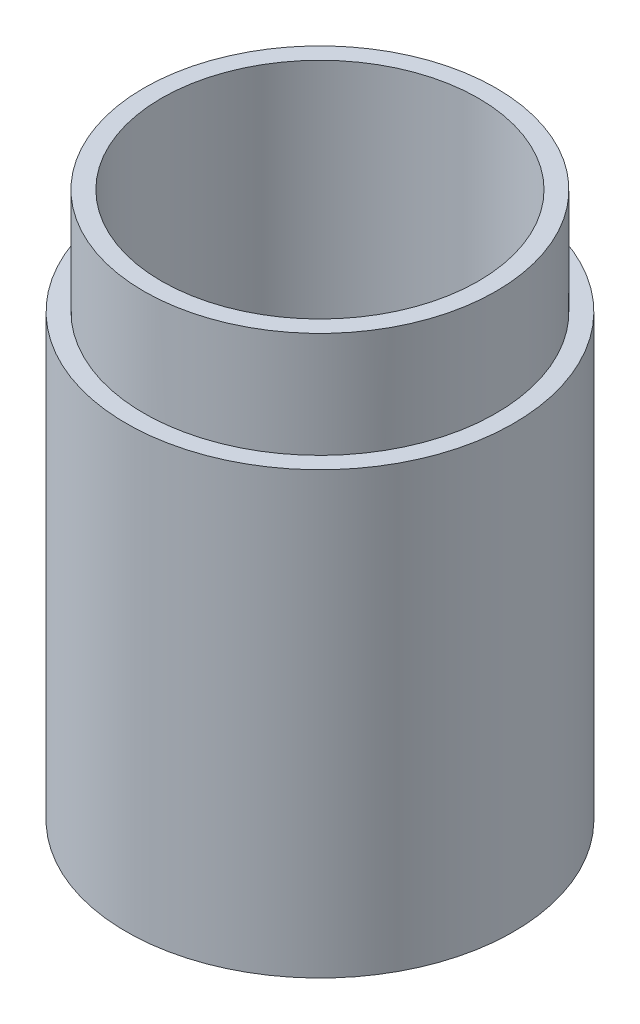
from build123d import *

# Parameters (mm, degrees)
SKETCH1_R           = 45
BOSS_EXTRUDE2_DEPTH = 150
SHELL1_T            = 5
SKETCH2_R           = 55
SKETCH2_R_2         = 50
BOSS_EXTRUDE3_DEPTH = 125


with BuildPart() as part:
    # Sketch1 → Boss-Extrude2 (new body)
    with BuildSketch(Plane(origin=(0, 0, 0), x_dir=(1, 0, 0), z_dir=(0, 1, 0))):
        with Locations(Location((0, 0, 0), (0, 0, 270))):
            Circle(SKETCH1_R)
    extrude(amount=BOSS_EXTRUDE2_DEPTH)

    # Shell1
    shell1_openings = [part.faces().sort_by_distance(p)[0] for p in [
        (0, 150, 0),
    ]]
    offset(amount=SHELL1_T, openings=shell1_openings, kind=Kind.INTERSECTION)

    # Sketch2 → Boss-Extrude3 (add)
    with BuildSketch(Plane(origin=(0, -5, 0), x_dir=(-1, 0, 0), z_dir=(0, -1, 0))):
        with Locations(Location((0, 0, 0), (0, 0, 90))):
            Circle(SKETCH2_R)
        with Locations(Location((0, 0, 0), (0, 0, 90))):
            Circle(SKETCH2_R_2, mode=Mode.SUBTRACT)
    extrude(amount=-BOSS_EXTRUDE3_DEPTH)


solid = part.part
